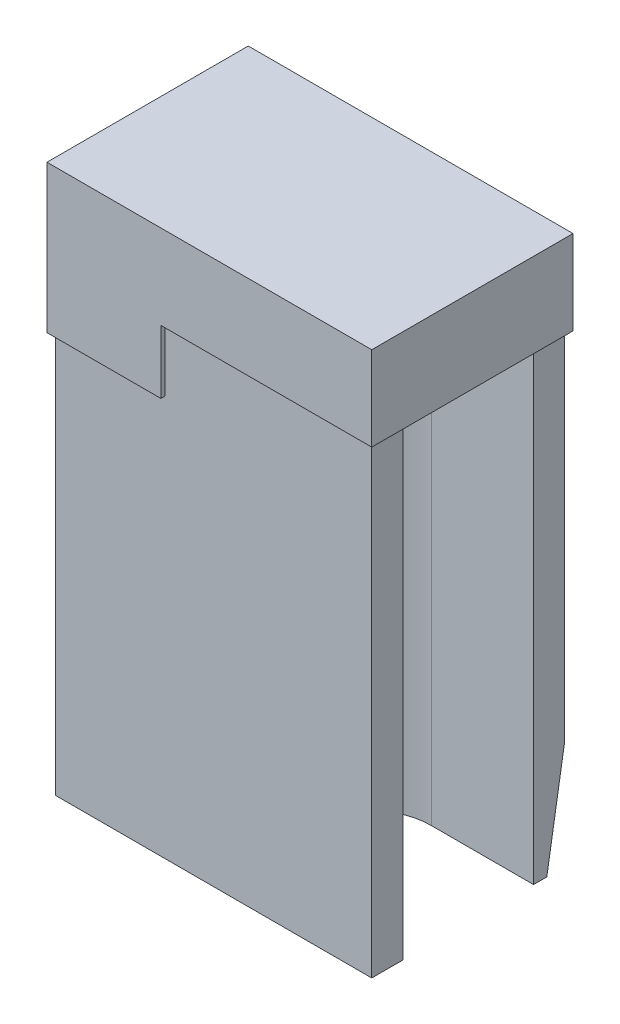
from build123d import *

# Parameters (mm, degrees)
BOSS_EXTRUDE1_DEPTH = 95
CUT_EXTRUDE1_DEPTH  = 124.177025455
BOSS_EXTRUDE2_DEPTH = 15
SKETCH4_W           = 50
SKETCH4_H           = 47.72
BOSS_EXTRUDE3_DEPTH = 20
SKETCH5_W           = 27
SKETCH5_H           = 47.72
BOSS_EXTRUDE4_DEPTH = 35


with BuildPart() as part:
    # Sketch1 → Boss-Extrude1 (new body)
    with BuildSketch(Plane(origin=(0, 0, 0), x_dir=(1, 0, 0), z_dir=(0, 1, 0))):
        with BuildLine():
            Line((-50.8, 22.86), (24.2, 22.86))
            Line((24.2, 22.86), (24.2, 15.5))
            Line((24.2, 15.5), (0, 15.5))
            ThreePointArc((0, 15.5), (-15.5, 0), (0, -15.5))
            Line((0, -15.5), (24.2, -15.5))
            Line((24.2, -15.5), (24.2, -22.86))
            Line((24.2, -22.86), (-50.8, -22.86))
            Line((-50.8, -22.86), (-50.8, 22.86))
        make_face()
    extrude(amount=BOSS_EXTRUDE1_DEPTH)

    # Sketch2 → Cut-Extrude1 (cut, through all)
    with BuildSketch(Plane(origin=(24.2, 0, 0), x_dir=(0, 0, -1), z_dir=(1, 0, 0))):
        Polygon((22.86, 0), (18.6436, 0), (22.86, 25.5524), align=None)
    extrude(amount=-CUT_EXTRUDE1_DEPTH, mode=Mode.SUBTRACT)

    # Sketch3 → Boss-Extrude2 (add)
    with BuildSketch(Plane(origin=(0, 95, 0), x_dir=(1, 0, 0), z_dir=(0, 1, 0))):
        with BuildLine():
            Line((24.2, 15.5), (24.2, 22.86))
            Line((24.2, 22.86), (-24.8, 22.86))
            Line((-24.8, 22.86), (-24.8, -22.86))
            Line((-24.8, -22.86), (24.2, -22.86))
            Line((24.2, -22.86), (24.2, -15.5))
            Line((24.2, -15.5), (0, -15.5))
            ThreePointArc((0, -15.5), (-15.5, 0), (0, 15.5))
            Line((0, 15.5), (24.2, 15.5))
        make_face()
    extrude(amount=BOSS_EXTRUDE2_DEPTH)

    # Sketch4 → Boss-Extrude3 (add)
    with BuildSketch(Plane(origin=(0, 110, 0), x_dir=(1, 0, 0), z_dir=(0, 1, 0))):
        with Locations((0.2, 0)):
            Rectangle(SKETCH4_W, SKETCH4_H)
    extrude(amount=BOSS_EXTRUDE3_DEPTH)

    # Sketch5 → Boss-Extrude4 (add)
    with BuildSketch(Plane(origin=(0, 95, 0), x_dir=(1, 0, 0), z_dir=(0, 1, 0))):
        with Locations((-38.3, 0)):
            Rectangle(SKETCH5_W, SKETCH5_H)
    extrude(amount=BOSS_EXTRUDE4_DEPTH)


solid = part.part
